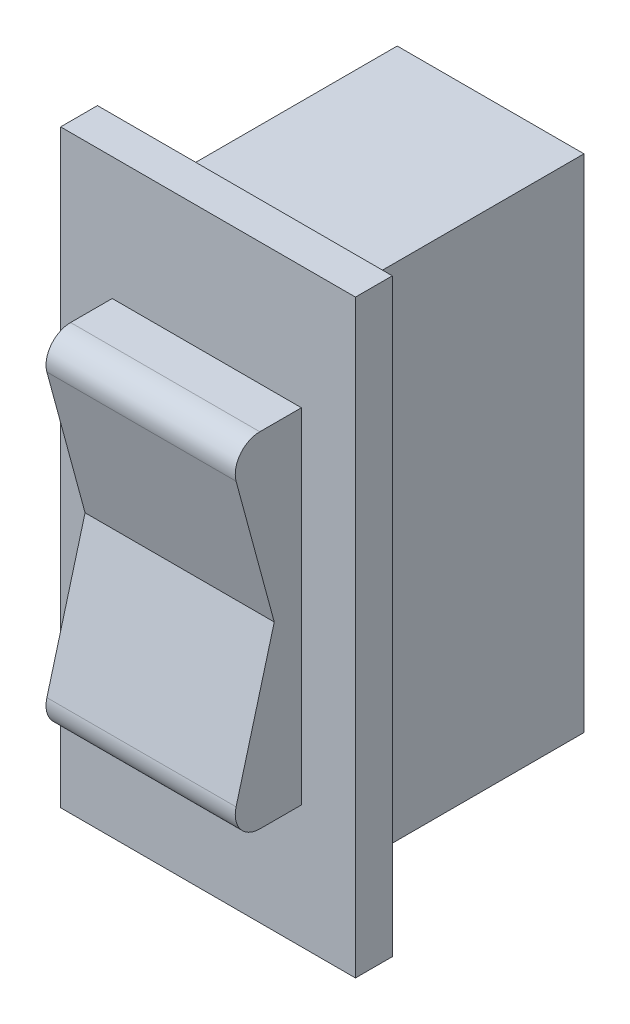
from build123d import *

# Parameters (mm, degrees)
SKETCH1_W           = 7.6
SKETCH1_H           = 20.4
BOSS_EXTRUDE1_DEPTH = 10
SKETCH2_W           = 12
SKETCH2_H           = 24
BOSS_EXTRUDE2_DEPTH = 1.5
BOSS_EXTRUDE3_DEPTH = 7.7
FILLET1_R           = 1


with BuildPart() as part:
    # Sketch1 → Boss-Extrude1 (new body)
    with BuildSketch(Plane.XY):
        Rectangle(SKETCH1_W, SKETCH1_H)
    extrude(amount=BOSS_EXTRUDE1_DEPTH)

    # Sketch2 → Boss-Extrude2 (add)
    with BuildSketch(Plane.XY.offset(10)):
        Rectangle(SKETCH2_W, SKETCH2_H)
    extrude(amount=BOSS_EXTRUDE2_DEPTH)

    # Sketch3 → Boss-Extrude3 (add)
    with BuildSketch(Plane(origin=(3.8, 0, 0), x_dir=(0, 0, -1), z_dir=(1, 0, 0))):
        Polygon((-11.5, 7), (-14.5, 7), (-12.604811218, 0), (-14.5, -7), (-11.5, -7), align=None)
    extrude(amount=-BOSS_EXTRUDE3_DEPTH)

    # Fillet1
    fillet1_edges = [part.edges().sort_by_distance(p)[0] for p in [
        (-0.05, -7, 14.5),
        (-0.05, 7, 14.5),
    ]]
    fillet(fillet1_edges, radius=FILLET1_R)


solid = part.part
